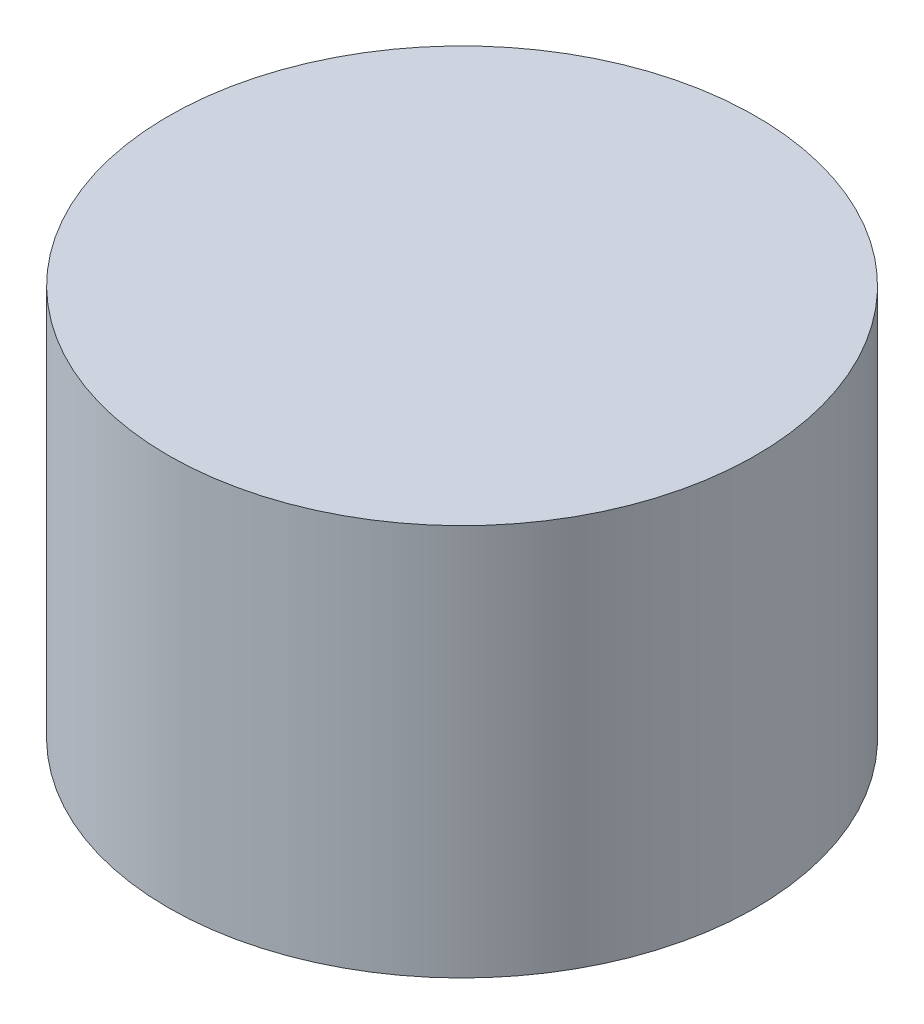
from build123d import *

# Parameters (mm, degrees)
SKETCH1_R           = 1.5
BOSS_EXTRUDE1_DEPTH = 1


with BuildPart() as part:
    # Sketch1 → Boss-Extrude1 (new, symmetric)
    with BuildSketch(Plane(origin=(0, 0, 0), x_dir=(1, 0, 0), z_dir=(0, 1, 0))):
        with Locations(Location((0, 0, 0), (0, 0, 270))):
            Circle(SKETCH1_R)
    extrude(amount=BOSS_EXTRUDE1_DEPTH, both=True)


solid = part.part
